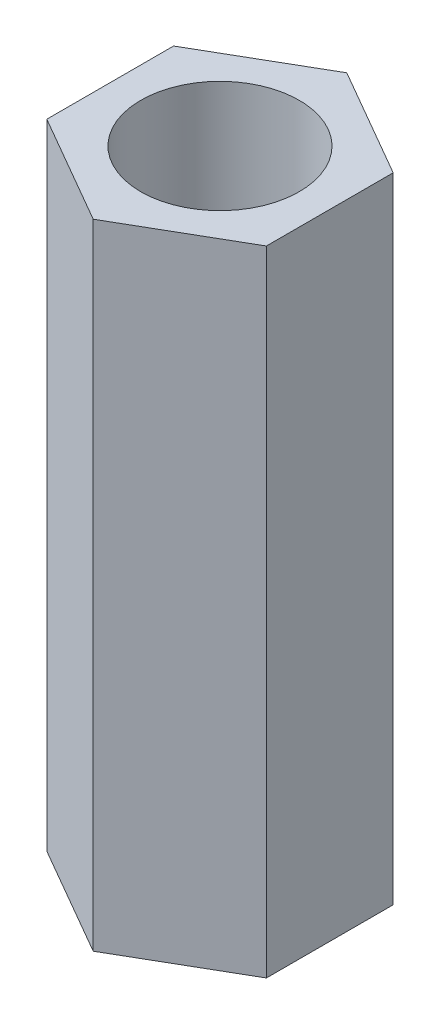
from build123d import *

# Parameters (mm, degrees)
SKETCH_1_R      = 1.25
EXTRUDE_1_DEPTH = 10


with BuildPart() as part:
    # 草图1 → 凸台-拉伸1 (new body)
    with BuildSketch(Plane(origin=(0, 0, 0), x_dir=(1, 0, 0), z_dir=(0, 1, 0))):
        Polygon((0, 2), (-1.732050808, 1), (-1.732050808, -1), (0, -2), (1.732050808, -1), (1.732050808, 1), align=None)
        with Locations(Location((0, 0, 0), (0, 0, 270))):
            Circle(SKETCH_1_R, mode=Mode.SUBTRACT)
    extrude(amount=EXTRUDE_1_DEPTH)


solid = part.part
